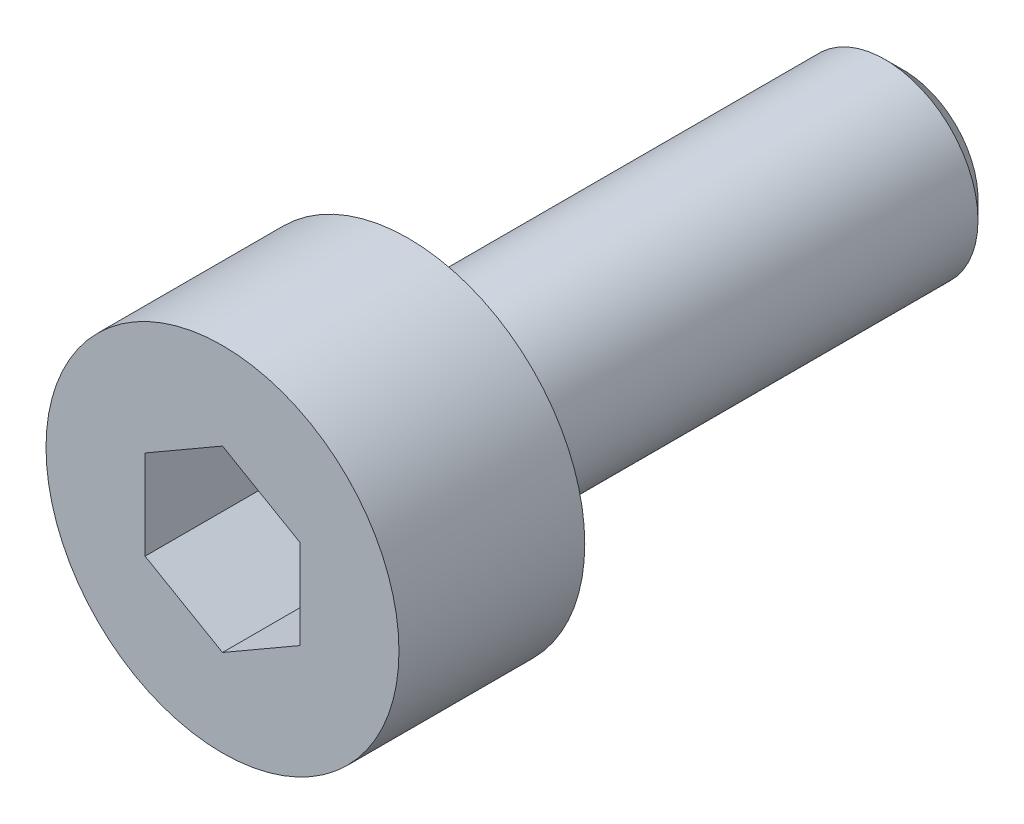
from build123d import *

# Parameters (mm, degrees)
SKETCH1_R           = 2.85
BOSS_EXTRUDE1_DEPTH = 3
SKETCH2_R           = 1.5
BOSS_EXTRUDE2_DEPTH = 8
CHAMFER1_SIZE       = 0.3
CUT_EXTRUDE1_DEPTH  = 2


with BuildPart() as part:
    # Sketch1 → Boss-Extrude1 (new body)
    with BuildSketch(Plane.XY):
        Circle(SKETCH1_R)
    extrude(amount=BOSS_EXTRUDE1_DEPTH)

    # Sketch2 → Boss-Extrude2 (add)
    with BuildSketch(Plane(origin=(0, 0, 0), x_dir=(-1, 0, 0), z_dir=(0, 0, -1))):
        with Locations(Location((0, 0, 0), (0, 0, 180))):
            Circle(SKETCH2_R)
    extrude(amount=BOSS_EXTRUDE2_DEPTH)

    # Chamfer1
    chamfer1_edges = [part.edges().sort_by_distance(p)[0] for p in [
        (-1.5, 0, -8),
    ]]
    chamfer(chamfer1_edges, length=CHAMFER1_SIZE)

    # Sketch3 → Cut-Extrude1 (cut)
    with BuildSketch(Plane.XY.offset(3)):
        Polygon((0, 1.443375673), (-1.25, 0.721687836), (-1.25, -0.721687836), (0, -1.443375673), (1.25, -0.721687836), (1.25, 0.721687836), align=None)
    extrude(amount=-CUT_EXTRUDE1_DEPTH, mode=Mode.SUBTRACT)


solid = part.part
